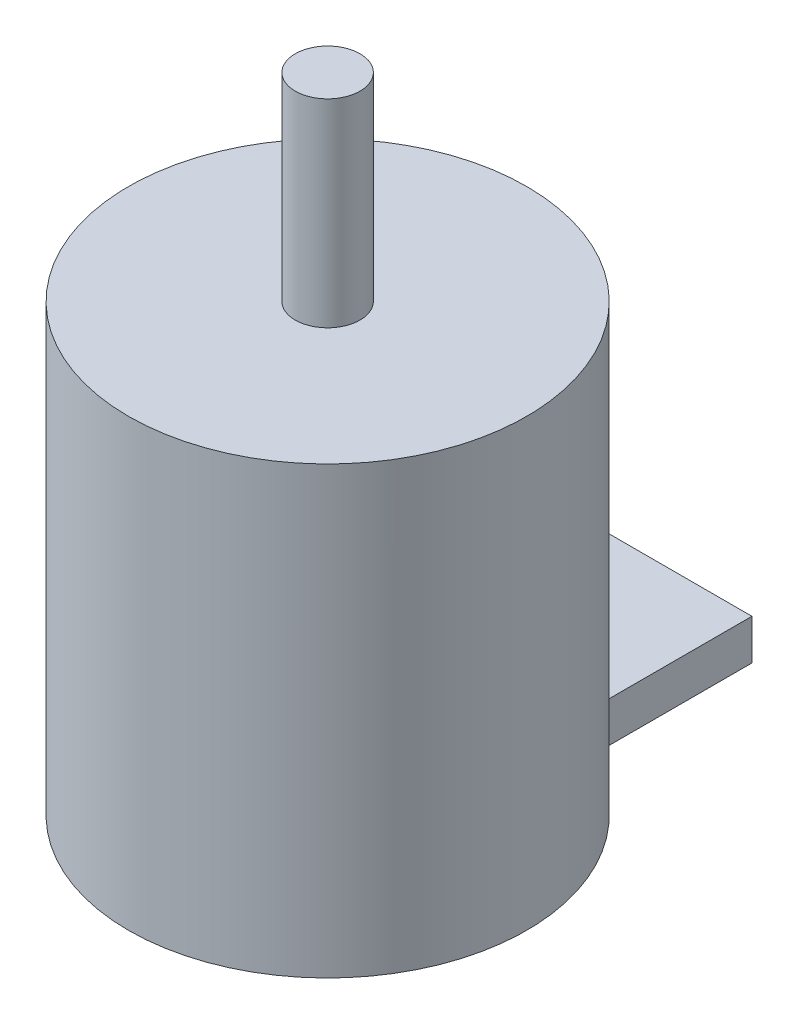
from build123d import *

# Parameters (mm, degrees)
SKETCH1_R           = 24.6
BOSS_EXTRUDE1_DEPTH = 55
SKETCH2_R           = 4
BOSS_EXTRUDE2_DEPTH = 24.5
SKETCH3_W           = 19.796892184
SKETCH3_H           = 20
BOSS_EXTRUDE3_DEPTH = 5


with BuildPart() as part:
    # Sketch1 → Boss-Extrude1 (new body)
    with BuildSketch(Plane(origin=(0, 0, 0), x_dir=(1, 0, 0), z_dir=(0, 1, 0))):
        with Locations(Location((0, 0, 0), (0, 0, 270))):
            Circle(SKETCH1_R)
    extrude(amount=BOSS_EXTRUDE1_DEPTH)

    # Sketch2 → Boss-Extrude2 (add)
    with BuildSketch(Plane(origin=(0, 55, 0), x_dir=(1, 0, 0), z_dir=(0, 1, 0))):
        with Locations(Location((0, 0, 0), (0, 0, 270))):
            Circle(SKETCH2_R)
    extrude(amount=BOSS_EXTRUDE2_DEPTH)

    # Sketch3 → Boss-Extrude3 (add)
    with BuildSketch(Plane.XZ):
        with Locations((0, -32.520674168)):
            Rectangle(SKETCH3_W, SKETCH3_H)
    extrude(amount=-BOSS_EXTRUDE3_DEPTH)


solid = part.part
